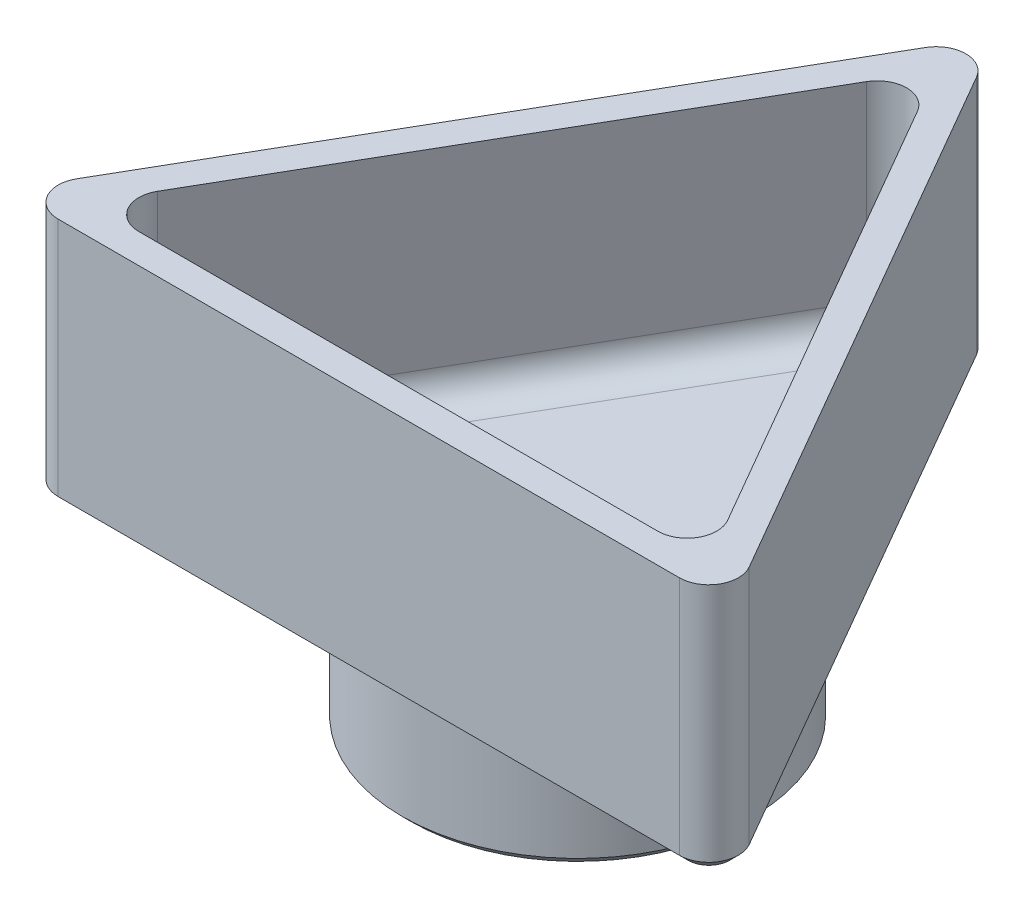
from build123d import *

# Parameters (mm, degrees)
BOSS_EXTRUDE1_DEPTH = 21.42998
SHELL1_T            = -2.54
SKETCH3_R           = 15.08125
BOSS_EXTRUDE2_DEPTH = 11.90498
FILLET1_R           = 2.54
FILLET2_R           = 2.54
FILLET3_R           = 2.54
CHAMFER2_SIZE       = 0.762
SKETCH5_R           = 12.54125
CUT_EXTRUDE1_DEPTH  = 11.90498
CHAMFER3_SIZE       = 0.762


with BuildPart() as part:
    # Sketch1 → Boss-Extrude1 (new body)
    with BuildSketch(Plane(origin=(0, 0, 0), x_dir=(1, 0, 0), z_dir=(0, 1, 0))):
        Polygon((0, 35.91687), (31.104921844, -17.958435), (-31.104921844, -17.958435), align=None)
    extrude(amount=BOSS_EXTRUDE1_DEPTH)

    # Shell1
    shell1_openings = [part.faces().sort_by_distance(p)[0] for p in [
        (0, 21.42998, 0),
    ]]
    offset(amount=SHELL1_T, openings=shell1_openings, kind=Kind.INTERSECTION)

    # Sketch3 → Boss-Extrude2 (add)
    with BuildSketch(Plane.XZ):
        with Locations(Location((0, 0, 0), (0, 0, 90))):
            Circle(SKETCH3_R)
    extrude(amount=BOSS_EXTRUDE2_DEPTH)

    # Fillet1
    fillet1_edges = [part.edges().sort_by_distance(p)[0] for p in [
        (0, 10.71499, -35.91687),
        (31.104921844, 10.71499, 17.958435),
        (-31.104921844, 10.71499, 17.958435),
    ]]
    fillet(fillet1_edges, radius=FILLET1_R)

    # Fillet2
    fillet2_edges = [part.edges().sort_by_distance(p)[0] for p in [
        (0, 11.98499, -30.83687),
        (-26.705512793, 11.98499, 15.418435),
        (26.705512793, 11.98499, 15.418435),
    ]]
    fillet(fillet2_edges, radius=FILLET2_R)

    # Fillet3
    fillet3_edges = [part.edges().sort_by_distance(p)[0] for p in [
        (13.352756397, 2.54, -7.7092175),
        (-13.352756397, 2.54, -7.7092175),
        (0, 2.54, 15.418435),
        (-24.505808268, 2.54, 14.148435),
        (24.505808268, 2.54, 14.148435),
        (0, 2.54, -28.29687),
    ]]
    fillet(fillet3_edges, radius=FILLET3_R)

    # Chamfer2
    chamfer2_edges = [part.edges().sort_by_distance(p)[0] for p in [
        (-15.552460922, 0, -8.9792175),
        (15.552460922, 0, -8.9792175),
        (0, 0, 17.958435),
        (-28.905217319, 0, 16.688435),
        (28.905217319, 0, 16.688435),
        (0, 0, -33.37687),
    ]]
    chamfer(chamfer2_edges, length=CHAMFER2_SIZE)

    # Sketch5 → Cut-Extrude1 (cut)
    with BuildSketch(Plane.XZ.offset(11.90498)):
        with Locations(Location((0, 0, 0), (0, 0, 270))):
            Circle(SKETCH5_R)
    extrude(amount=-CUT_EXTRUDE1_DEPTH, mode=Mode.SUBTRACT)

    # Chamfer3
    chamfer3_edges = [part.edges().sort_by_distance(p)[0] for p in [
        (0, -11.90498, -15.08125),
    ]]
    chamfer(chamfer3_edges, length=CHAMFER3_SIZE)


solid = part.part
